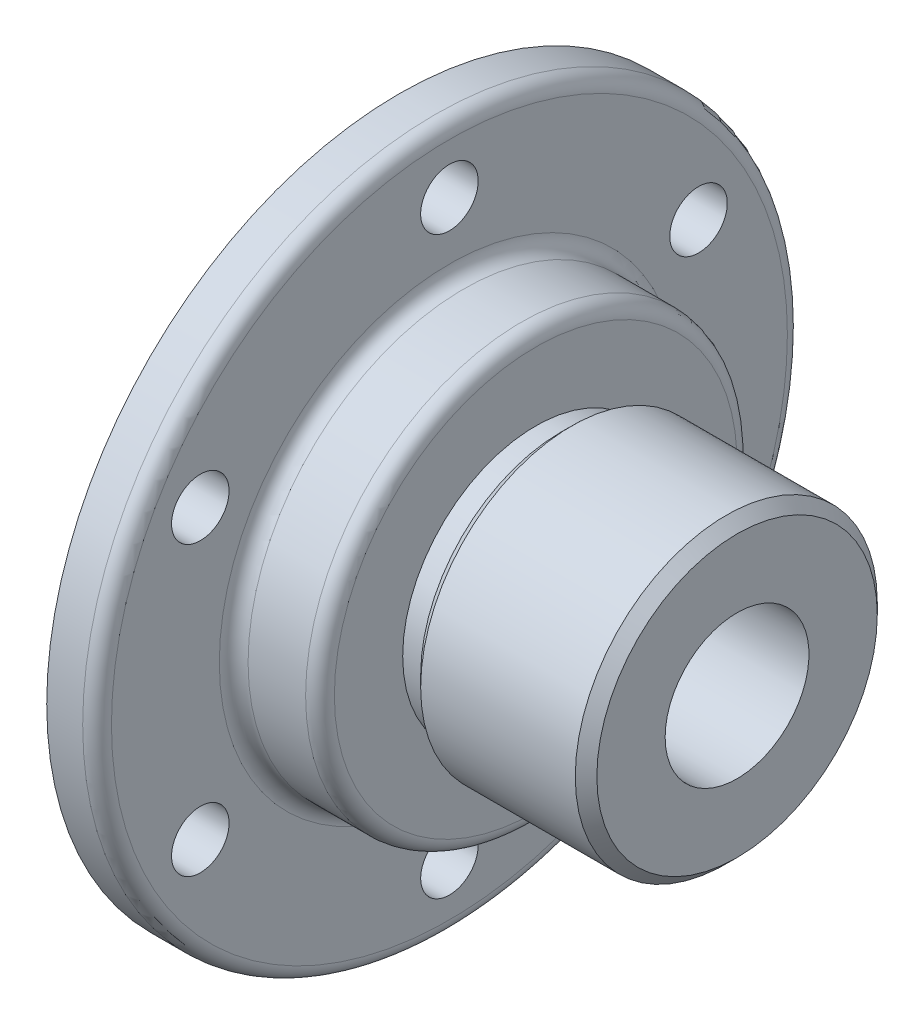
from build123d import *

# Parameters (mm, degrees)
CHAMFER_1_SIZE           = 1.5
SKETCH_3_R               = 4
CUT_EXTRUDE_1_DEPTH      = 81.012499024
PATTERN_CIRCULAR_1_COUNT = 6
FILLET_1_R               = 2


with BuildPart() as part:
    # 草圖1 → 旋轉1 (revolve)
    with BuildSketch(Plane.XY, mode=Mode.PRIVATE) as revolve_1_sk:
        Polygon((0, 0), (0, 49), (7, 49), (7, 30), (19, 30), (19, 18.5), (22.5, 18.5), (22.5, 21), (47, 21), (47, 0), align=None)
    revolve(revolve_1_sk.sketch.rotate(Axis((0, 0, 0), (1, 0, 0)), 90), axis=Axis((0, 0, 0), (1, 0, 0)))

    # 草圖2 → 除料-旋轉1 (revolve, cut)
    with BuildSketch(Plane.XY, mode=Mode.PRIVATE) as cut_revolve_1_sk:
        Polygon((47, 0), (47, 10), (10, 10), (10, 22.5), (0, 22.5), (0, 0), align=None)
    revolve(cut_revolve_1_sk.sketch.rotate(Axis((0, 0, 0), (1, 0, 0)), 90), axis=Axis((0, 0, 0), (1, 0, 0)), mode=Mode.SUBTRACT)

    # 導角1
    chamfer_1_edges = [part.edges().sort_by_distance(p)[0] for p in [
        (47, 0, -21),
        (22.5, 0, -21),
    ]]
    chamfer(chamfer_1_edges, length=CHAMFER_1_SIZE)

    # 草圖3 → 伸長1 (cut, through all)
    with BuildSketch(Plane(origin=(7, 0, 0), x_dir=(0, 0, -1), z_dir=(1, 0, 0))):
        with Locations((0, 40)):
            Circle(SKETCH_3_R)
    cut_extrude_1 = extrude(amount=-CUT_EXTRUDE_1_DEPTH, mode=Mode.SUBTRACT)

    # 環狀複製排列1: 伸長1 ×6 about axis
    pattern_circular_1_axis = Axis((0, 0, 0), (1, 0, 0))
    for i in range(1, PATTERN_CIRCULAR_1_COUNT):
        add(cut_extrude_1.rotate(pattern_circular_1_axis, i * 360 / PATTERN_CIRCULAR_1_COUNT), mode=Mode.SUBTRACT)

    # 圓角1
    fillet_1_edges = [part.edges().sort_by_distance(p)[0] for p in [
        (7, 0, -49),
        (19, 0, -30),
        (7, 0, -30),
    ]]
    fillet(fillet_1_edges, radius=FILLET_1_R)


solid = part.part
